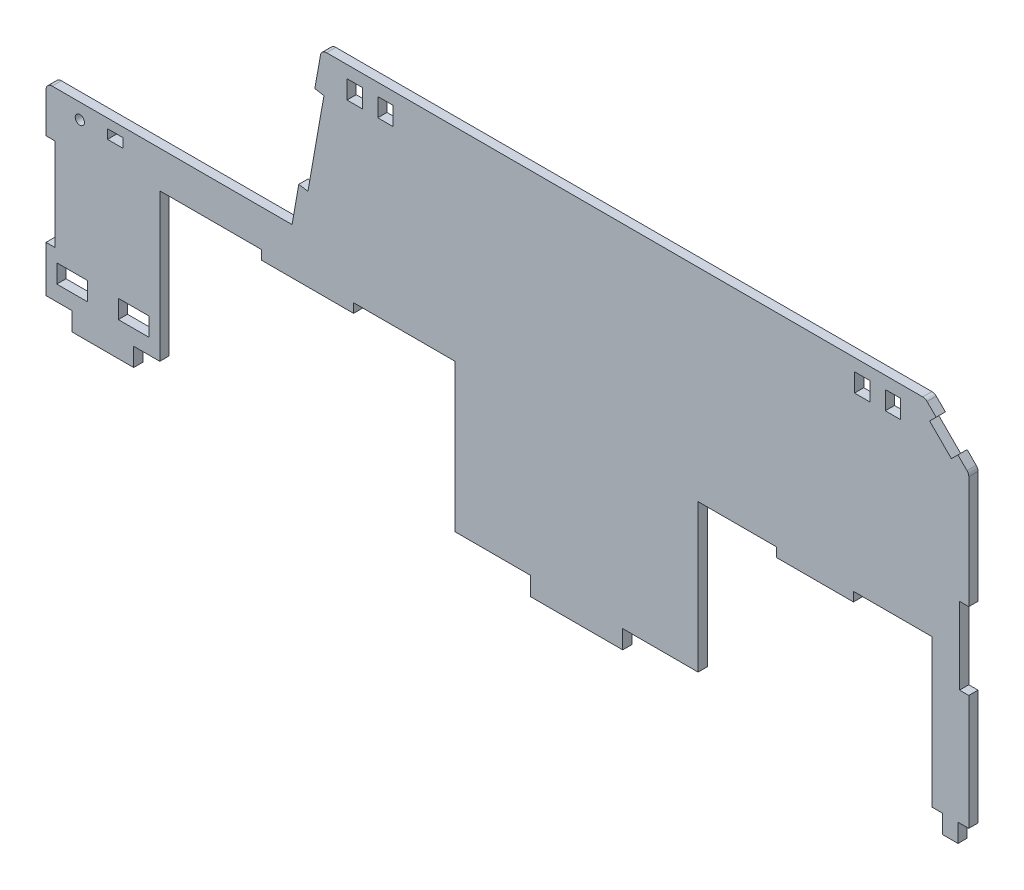
from build123d import *

# Parameters (mm, degrees)
BOSS_EXTRUDE1_DEPTH = 3
SKETCH2_W           = 3
SKETCH2_H           = 30
CUT_EXTRUDE1_DEPTH  = 321.943920335
SKETCH3_W           = 10
SKETCH3_H           = 6
CUT_EXTRUDE2_DEPTH  = 321.943920335
SKETCH4_R           = 1.5
SKETCH4_W           = 5
SKETCH4_H           = 3
CUT_EXTRUDE3_DEPTH  = 321.943920335
SKETCH5_W           = 5
SKETCH5_H           = 6
CUT_EXTRUDE4_DEPTH  = 321.943920335
FILLET1_R           = 2


with BuildPart() as part:
    # Sketch1 → Boss-Extrude1 (new body)
    with BuildSketch(Plane.XY):
        Polygon((0, 0), (8.5, 0), (8.5, -6), (28.5, -6), (28.5, 0), (37, 0), (37, 48), (70, 48), (70, 45), (100, 45), (100, 48), (133, 48), (133, 0), (157.5, 0), (157.5, -6), (187.5, -6), (187.5, 0), (212, 0), (212, 48), (237.5, 48), (237.5, 45), (262.5, 45), (262.5, 48), (288, 48), (288, 0), (291.5, 0), (291.5, -6), (296.5, -6), (296.5, 0), (300, 0), (300, 37.428932188), (297, 37.428932188), (297, 62.428932188), (300, 62.428932188), (300, 99.857864376), (296.464466094, 103.393398282), (294.343145751, 101.272077939), (287.272077939, 108.343145751), (289.393398282, 110.464466094), (285.857864376, 114), (89.521656958, 114), (80, 60), (0, 60), align=None)
    extrude(amount=BOSS_EXTRUDE1_DEPTH)

    # Sketch2 → Cut-Extrude1 (cut, through all)
    with BuildSketch(Plane(origin=(0, 0, 0), x_dir=(-1, 0, 0), z_dir=(0, 0, -1))):
        Polygon((-87.40573319, 102), (-90.360156449, 101.479055467), (-85.150711119, 71.934822877), (-82.19628786, 72.45576741), align=None)
        with Locations((-1.5, 30)):
            Rectangle(SKETCH2_W, SKETCH2_H)
    extrude(amount=-CUT_EXTRUDE1_DEPTH, mode=Mode.SUBTRACT)

    # Sketch3 → Cut-Extrude2 (cut, through all)
    with BuildSketch(Plane(origin=(0, 0, 0), x_dir=(-1, 0, 0), z_dir=(0, 0, -1))):
        with Locations((-28.5, 8)):
            Rectangle(SKETCH3_W, SKETCH3_H)
        with Locations((-8.5, 8)):
            Rectangle(SKETCH3_W, SKETCH3_H)
    extrude(amount=-CUT_EXTRUDE2_DEPTH, mode=Mode.SUBTRACT)

    # Sketch4 → Cut-Extrude3 (cut, through all)
    with BuildSketch(Plane(origin=(0, 0, 0), x_dir=(-1, 0, 0), z_dir=(0, 0, -1))):
        with Locations((-11, 55)):
            Circle(SKETCH4_R)
        with Locations((-22.5, 55.5)):
            Rectangle(SKETCH4_W, SKETCH4_H)
    extrude(amount=-CUT_EXTRUDE3_DEPTH, mode=Mode.SUBTRACT)

    # Sketch5 → Cut-Extrude4 (cut, through all)
    with BuildSketch(Plane(origin=(0, 0, 0), x_dir=(-1, 0, 0), z_dir=(0, 0, -1))):
        with Locations((-275.357864376, 107)):
            Rectangle(SKETCH5_W, SKETCH5_H)
        with Locations((-265.357864376, 107)):
            Rectangle(SKETCH5_W, SKETCH5_H)
        with Locations((-110.357864376, 107)):
            Rectangle(SKETCH5_W, SKETCH5_H)
        with Locations((-100.357864376, 107)):
            Rectangle(SKETCH5_W, SKETCH5_H)
    extrude(amount=-CUT_EXTRUDE4_DEPTH, mode=Mode.SUBTRACT)

    # Fillet1
    fillet1_edges = [part.edges().sort_by_distance(p)[0] for p in [
        (0, 60, 1.5),
        (89.521656958, 114, 1.5),
        (285.857864376, 114, 1.5),
        (300, 99.857864376, 1.5),
    ]]
    fillet(fillet1_edges, radius=FILLET1_R)


solid = part.part
